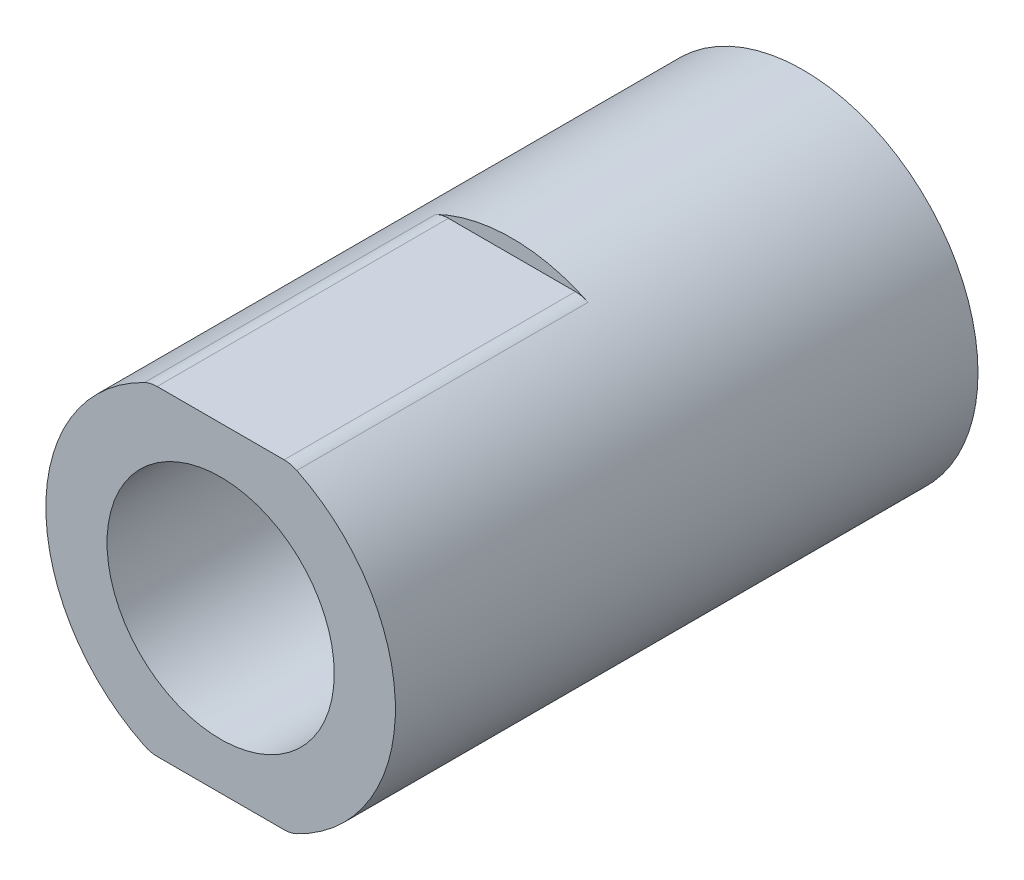
from build123d import *

# Parameters (mm, degrees)
SKETCH1_R           = 6
SKETCH1_R_2         = 2.4
BOSS_EXTRUDE1_DEPTH = 20
SKETCH2_R           = 3.9
CUT_EXTRUDE1_DEPTH  = 7.5
CUT_EXTRUDE2_START  = -10
CUT_EXTRUDE2_DEPTH  = 10
FILLET1_R           = 1


with BuildPart() as part:
    # Sketch1 → Boss-Extrude1 (new body)
    with BuildSketch(Plane.XY):
        Circle(SKETCH1_R)
        Circle(SKETCH1_R_2, mode=Mode.SUBTRACT)
    extrude(amount=BOSS_EXTRUDE1_DEPTH)

    # Sketch2 → Cut-Extrude1 (cut)
    with BuildSketch(Plane.XY.offset(20)):
        Circle(SKETCH2_R)
    extrude(amount=-CUT_EXTRUDE1_DEPTH, mode=Mode.SUBTRACT)

    # Sketch4 → Cut-Extrude2 (cut)
    with BuildSketch(Plane.XY.offset(20).offset(CUT_EXTRUDE2_START)):
        with BuildLine():
            Line((-2.397915762, 5.5), (2.397915762, 5.5))
            ThreePointArc((2.397915762, 5.5), (0, 6), (-2.397915762, 5.5))
        make_face()
        with BuildLine():
            Line((2.397915762, -5.5), (-2.397915762, -5.5))
            ThreePointArc((-2.397915762, -5.5), (0, -6), (2.397915762, -5.5))
        make_face()
    extrude(amount=CUT_EXTRUDE2_DEPTH, mode=Mode.SUBTRACT)

    # Fillet1
    fillet1_edges = [part.edges().sort_by_distance(p)[0] for p in [
        (-2.397915762, 5.5, 15),
        (2.397915762, 5.5, 15),
        (2.397915762, -5.5, 15),
        (-2.397915762, -5.5, 15),
    ]]
    fillet(fillet1_edges, radius=FILLET1_R)


solid = part.part
